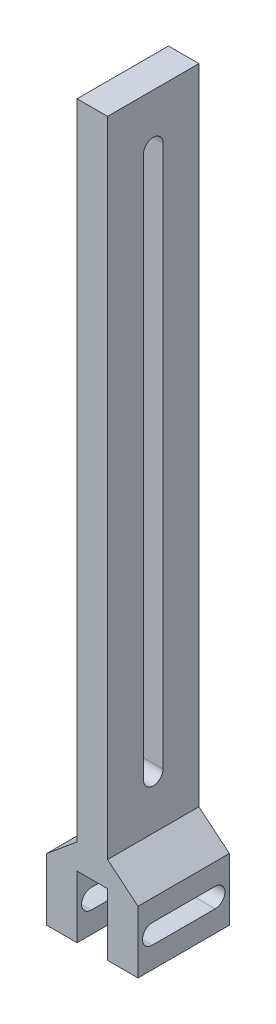
from build123d import *

# Parameters (mm, degrees)
BOSS_EXTRU_1_DEPTH      = 7.5
ENL_V_MAT_EXTRU_1_DEPTH = 25
ENL_V_MAT_EXTRU_2_DEPTH = 25


with BuildPart() as part:
    # Esquisse1 → Boss.-Extru.1 (new, symmetric)
    with BuildSketch(Plane.XY):
        Polygon((-7.5, 0), (-2.5, 0), (-2.5, 10.2), (2.5, 10.2), (2.5, 0), (7.5, 0), (7.5, 10.2), (2.5, 14.34186057), (2.5, 120), (-2.5, 120), (-2.5, 14.34186057), (-7.5, 10.2), align=None)
    extrude(amount=BOSS_EXTRU_1_DEPTH, both=True)

    # Esquisse2 → Enlèv. mat.-Extru.1 (cut)
    with BuildSketch(Plane.ZY.offset(7.5)):
        with BuildLine():
            Line((-5.164295133, 6.7), (5.164295133, 6.7))
            ThreePointArc((5.164295133, 6.7), (6.764295133, 5.1), (5.164295133, 3.5))
            Line((5.164295133, 3.5), (-5.164295133, 3.5))
            ThreePointArc((-5.164295133, 3.5), (-6.764295133, 5.1), (-5.164295133, 6.7))
        make_face()
    extrude(amount=-ENL_V_MAT_EXTRU_1_DEPTH, mode=Mode.SUBTRACT)

    # Esquisse3 → Enlèv. mat.-Extru.2 (cut)
    with BuildSketch(Plane.ZY.offset(2.5)):
        with BuildLine():
            Line((-1.6, 22.673972566), (-1.6, 111.667888004))
            ThreePointArc((-1.6, 111.667888004), (0, 113.267888004), (1.6, 111.667888004))
            Line((1.6, 111.667888004), (1.6, 22.673972566))
            ThreePointArc((1.6, 22.673972566), (0, 21.073972566), (-1.6, 22.673972566))
        make_face()
    extrude(amount=-ENL_V_MAT_EXTRU_2_DEPTH, mode=Mode.SUBTRACT)


solid = part.part
